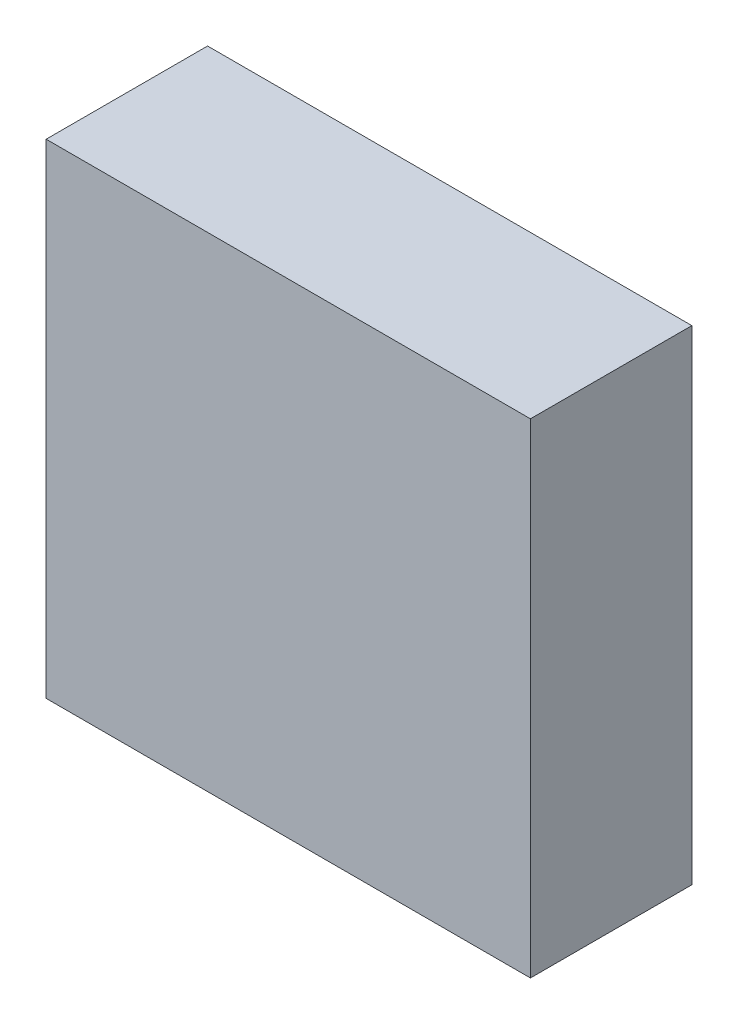
from build123d import *

# Parameters (mm, degrees)
SKETCH_1_W                      = 60
SKETCH_1_H                      = 60
SAMPLE_WORKPIECE_60X60X20_DEPTH = 20


with BuildPart() as part:
    # 草图1 → Sample_workpiece_60x60x20 (new body)
    with BuildSketch(Plane.XY):
        with Locations((30, 30)):
            Rectangle(SKETCH_1_W, SKETCH_1_H)
    extrude(amount=SAMPLE_WORKPIECE_60X60X20_DEPTH)


solid = part.part
